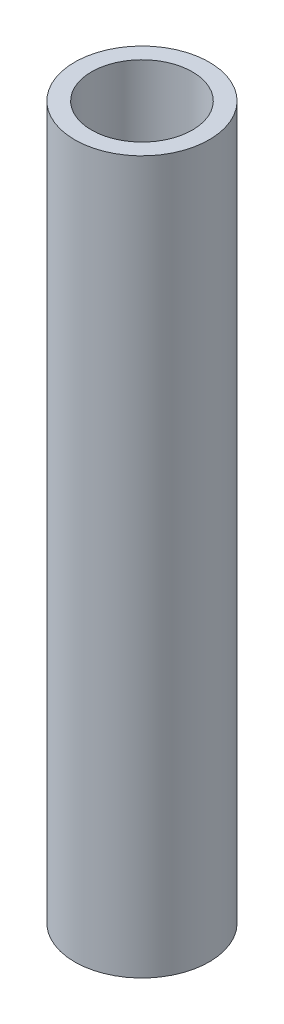
from build123d import *

# Parameters (mm, degrees)
SKETCH1_R           = 12
BOSS_EXTRUDE1_DEPTH = 127
SKETCH2_R           = 9
CUT_EXTRUDE1_DEPTH  = 254


with BuildPart() as part:
    # Sketch1 → Boss-Extrude1 (new body)
    with BuildSketch(Plane(origin=(0, 0, 0), x_dir=(1, 0, 0), z_dir=(0, 1, 0))):
        with Locations(Location((0, 0, 0), (0, 0, 270))):
            Circle(SKETCH1_R)
    extrude(amount=BOSS_EXTRUDE1_DEPTH)

    # Sketch2 → Cut-Extrude1 (cut)
    with BuildSketch(Plane(origin=(0, 127, 0), x_dir=(1, 0, 0), z_dir=(0, 1, 0))):
        with Locations(Location((0, 0, 0), (0, 0, 270))):
            Circle(SKETCH2_R)
    extrude(amount=-CUT_EXTRUDE1_DEPTH, mode=Mode.SUBTRACT)


solid = part.part
